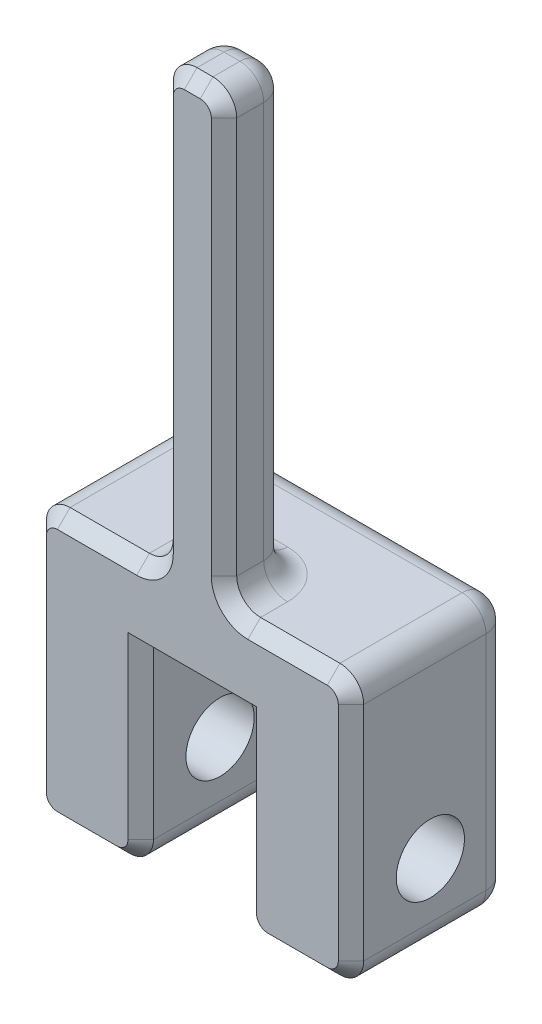
from build123d import *

# Parameters (mm, degrees)
SKETCH1_W           = 20
SKETCH1_H           = 10
BOSS_EXTRUDE1_DEPTH = 10
SKETCH2_R           = 2.15
CUT_EXTRUDE1_DEPTH  = 23.912878475
SKETCH3_W           = 4
SKETCH3_H           = 4
BOSS_EXTRUDE2_DEPTH = 35
BOSS_EXTRUDE3_REACH = 51.497
SKETCH4_W           = 10
SKETCH4_H           = 7
SKETCH5_W           = 6.5
SKETCH5_H           = 10
CUT_EXTRUDE2_DEPTH  = 12
FILLET1_R           = 1.5
CHAMFER1_SIZE       = 0.8


with BuildPart() as part:
    # Sketch1 → Boss-Extrude1 (new body)
    with BuildSketch(Plane(origin=(0, 0, 0), x_dir=(1, 0, 0), z_dir=(0, 1, 0))):
        Rectangle(SKETCH1_W, SKETCH1_H)
    extrude(amount=BOSS_EXTRUDE1_DEPTH)

    # Sketch2 → Cut-Extrude1 (cut, through all)
    with BuildSketch(Plane(origin=(10, 0, 0), x_dir=(0, 0, -1), z_dir=(1, 0, 0))):
        with Locations((0, 5)):
            Circle(SKETCH2_R)
    extrude(amount=-CUT_EXTRUDE1_DEPTH, mode=Mode.SUBTRACT)

    # Sketch3 → Boss-Extrude2 (add)
    with BuildSketch(Plane(origin=(0, 10, 0), x_dir=(1, 0, 0), z_dir=(0, 1, 0))):
        with Locations((0, -3)):
            Rectangle(SKETCH3_W, SKETCH3_H)
    extrude(amount=BOSS_EXTRUDE2_DEPTH)

    # Boss-Extrude3: up to this face of the body (flat: up to its plane)
    boss_extrude3_end = Plane(part.part.faces().sort_by_distance((-10, 5, -4.858578644))[0])
    # Sketch4 → Boss-Extrude3 (add, up to the picked face)
    with BuildSketch(Plane(origin=(10, 0, 0), x_dir=(0, 0, -1), z_dir=(1, 0, 0)), mode=Mode.PRIVATE) as boss_extrude3_sk1:
        with Locations((0, 13.5)):
            Rectangle(SKETCH4_W, SKETCH4_H)
    boss_extrude3_tool1 = split(extrude(boss_extrude3_sk1.sketch, amount=-BOSS_EXTRUDE3_REACH, mode=Mode.PRIVATE), bisect_by=boss_extrude3_end, keep=Keep.BOTH, mode=Mode.PRIVATE)
    add(boss_extrude3_tool1.solids().sort_by(Axis((10, 13.5, 0), (-1, 0, 0)))[0])

    # Sketch5 → Cut-Extrude2 (cut)
    with BuildSketch(Plane.XZ):
        Rectangle(SKETCH5_W, SKETCH5_H)
    extrude(amount=-CUT_EXTRUDE2_DEPTH, mode=Mode.SUBTRACT)

    # Fillet1
    fillet1_edges = [part.edges().sort_by_distance(p)[0] for p in [
        (-2, 31, 1),
        (2, 31, 1),
        (-2, 45, 3),
        (2, 45, 3),
        (0, 45, 1),
        (0, 17, 1),
        (-2, 17, 3),
        (2, 17, 3),
        (0, 17, -5),
        (10, 17, 0),
        (-10, 17, 0),
        (-10, 0, 0),
        (-6.625, 0, -5),
        (6.625, 0, -5),
        (-3.25, 6, -5),
        (10, 0, 0),
        (0, 12, -5),
        (3.25, 6, -5),
        (-3.25, 0, 0),
        (3.25, 0, 0),
        (-10, 8.5, -5),
        (10, 8.5, -5),
    ]]
    fillet(fillet1_edges, radius=FILLET1_R)

    # Chamfer1
    chamfer1_edges = [part.edges().sort_by_distance(p)[0] for p in [
        (-6.625, 0, 5),
        (-9.560660172, 16.560660172, 5),
        (9.560660172, 16.560660172, 5),
        (-9.560660172, 0.439339828, 5),
        (9.560660172, 0.439339828, 5),
        (3.689339828, 0.439339828, 5),
        (-3.689339828, 0.439339828, 5),
        (-1.560660172, 44.560660172, 5),
        (1.560660172, 44.560660172, 5),
        (-2.439339828, 17.439339828, 5),
        (2.439339828, 17.439339828, 5),
        (3.25, 6.75, 5),
        (0, 12, 5),
        (-3.25, 6.75, 5),
        (-2, 31, 5),
        (6, 17, 5),
        (-6, 17, 5),
        (2, 31, 5),
        (0, 45, 5),
        (6.625, 0, 5),
        (10, 8.5, 5),
        (-10, 8.5, 5),
    ]]
    chamfer(chamfer1_edges, length=CHAMFER1_SIZE)


solid = part.part
